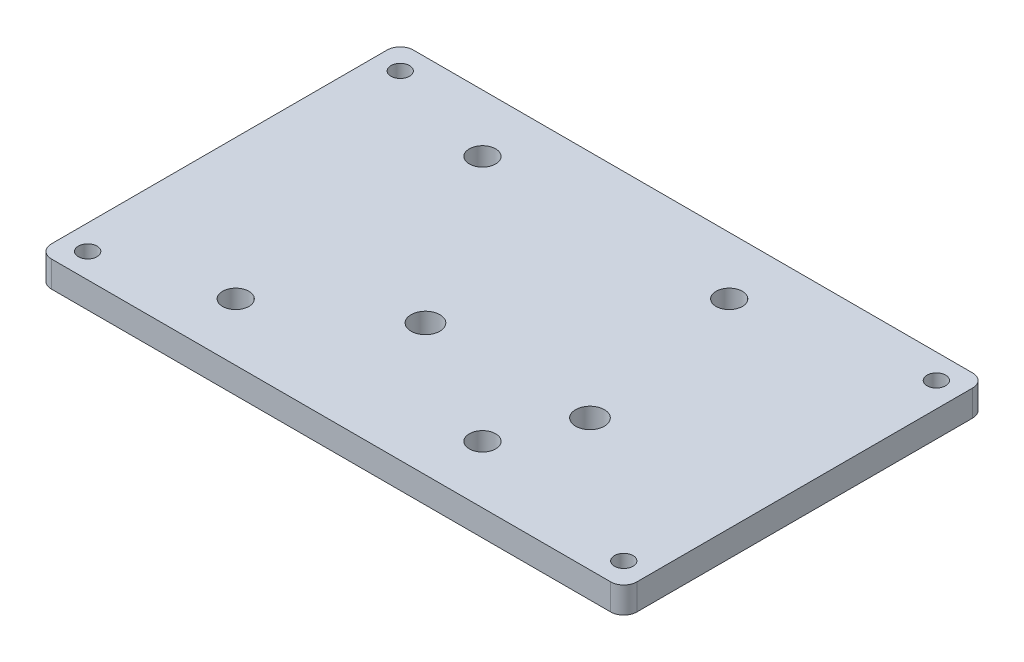
from build123d import *

# Parameters (mm, degrees)
SKETCH1_W             = 44
SKETCH1_H             = 44
SKETCH1_R             = 1.6
SKETCH1_R_2           = 1.75
SKETCH1_W_2           = 7.18
BOSS_EXTRUDE1_DEPTH   = 3.175
SKETCH2_W             = 10
SKETCH2_H             = 44
BOSS_EXTRUDE2_DEPTH   = 3.175
F_4_40_TAPPED_HOLE1_D = 2.2606
FILLET2_R             = 1.5875


with BuildPart() as part:
    # Sketch1 → Boss-Extrude1 (new body)
    # profile 1 of 2: a face of its own
    with BuildSketch(Plane(origin=(0, 0, 0), x_dir=(1, 0, 0), z_dir=(0, 1, 0))):
        with Locations((22, -22)):
            Rectangle(SKETCH1_W, SKETCH1_H)
        with Locations(Location((7, -37, 0), (0, 0, 270))):
            Circle(SKETCH1_R, mode=Mode.SUBTRACT)
        with Locations(Location((21.07, -28, 0), (0, 0, 270))):
            Circle(SKETCH1_R_2, mode=Mode.SUBTRACT)
        with Locations(Location((37, -37, 0), (0, 0, 270))):
            Circle(SKETCH1_R, mode=Mode.SUBTRACT)
        with Locations(Location((41.07, -28, 0), (0, 0, 270))):
            Circle(SKETCH1_R_2, mode=Mode.SUBTRACT)
        with Locations(Location((7, -7, 0), (0, 0, 270))):
            Circle(SKETCH1_R, mode=Mode.SUBTRACT)
        with Locations(Location((37, -7, 0), (0, 0, 270))):
            Circle(SKETCH1_R, mode=Mode.SUBTRACT)
    # profile 2 of 2: a face of its own
    with BuildSketch(Plane(origin=(0, 0, 0), x_dir=(1, 0, 0), z_dir=(0, 1, 0))):
        with Locations((47.59, -22)):
            Rectangle(SKETCH1_W_2, SKETCH1_H)
    extrude(amount=BOSS_EXTRUDE1_DEPTH)

    # Sketch2 → Boss-Extrude2 (add)
    with BuildSketch(Plane(origin=(0, 3.175, 0), x_dir=(1, 0, 0), z_dir=(0, 1, 0))):
        with Locations((-5, -22)):
            Rectangle(SKETCH2_W, SKETCH2_H)
        with Locations((56.18, -22)):
            Rectangle(SKETCH2_W, SKETCH2_H)
    extrude(amount=-BOSS_EXTRUDE2_DEPTH)

    # #4-40 Tapped Hole1 (through all)
    with Locations(Plane(origin=(-7, 3.175, 3), x_dir=(0, 0, 1), z_dir=(0, 1, 0))):
        with Locations((0, 0), (38, 0), (0, 65.18), (38, 65.18)):
            Hole(F_4_40_TAPPED_HOLE1_D / 2)

    # Fillet2
    fillet2_edges = [part.edges().sort_by_distance(p)[0] for p in [
        (-10, 1.5875, 0),
        (-10, 1.5875, 44),
        (61.18, 1.5875, 44),
        (61.18, 1.5875, 0),
    ]]
    fillet(fillet2_edges, radius=FILLET2_R)


solid = part.part
